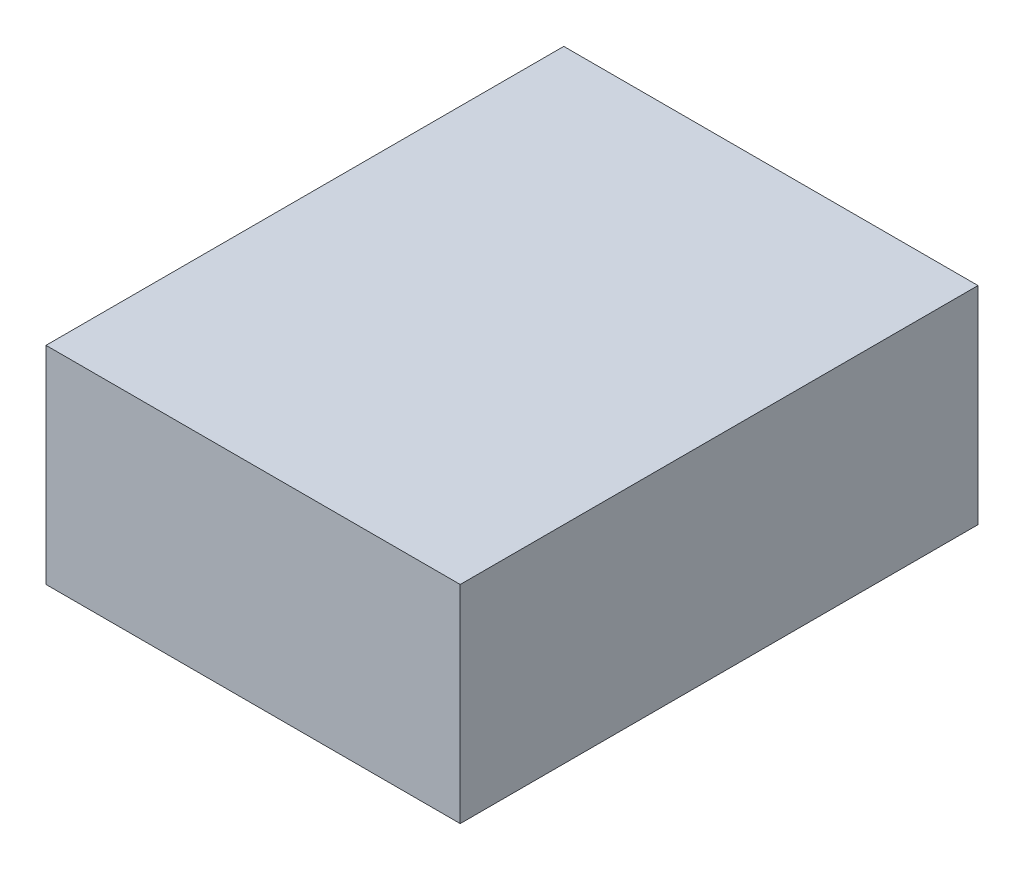
from build123d import *

# Parameters (mm, degrees)
SKETCH2_W           = 101.6
SKETCH2_H           = 50.8
BOSS_EXTRUDE1_DEPTH = 127


with BuildPart() as part:
    # Sketch2 → Boss-Extrude1 (new body)
    with BuildSketch(Plane.XY):
        with Locations((50.8, 25.4)):
            Rectangle(SKETCH2_W, SKETCH2_H)
    extrude(amount=BOSS_EXTRUDE1_DEPTH)


solid = part.part
